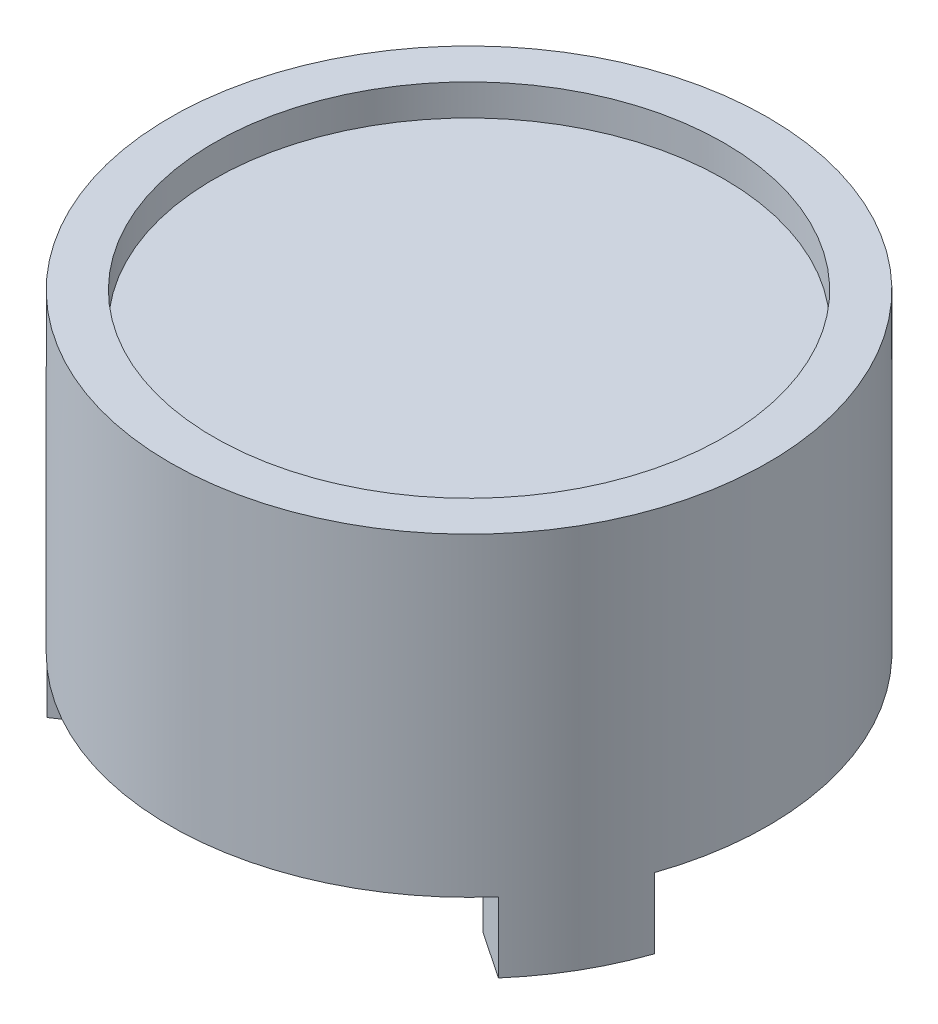
from build123d import *
from build123d.topology import SkipClean

# Parameters (mm, degrees)
TOOTH_DEPTH       = 4
THREE_TEETH_COUNT = 3
FILLET1_R         = 0.254


with BuildPart() as part:
    # Sketch4 → Revolve1 (revolve)
    with BuildSketch(Plane.XY, mode=Mode.PRIVATE) as revolve1_sk:
        Polygon((0, 16.1036), (14.5, 16.1036), (14.5, 17.8816), (17, 17.8816), (17, 0), (13.5, 0), (13.5, 1), (14.5, 1), (14.5, 3.4036), (0, 3.4036), align=None)
    revolve(revolve1_sk.sketch.rotate(Axis((0, 0, 0), (0, 1, 0)), 90), axis=Axis((0, 0, 0), (0, 1, 0)))

    # Sketch3 → Tooth (add)
    with SkipClean():  # the faces are left unmerged after this step: merging them gives an invalid solid
        with BuildSketch(Plane(origin=(0, 0, 0), x_dir=(1, 0, 0), z_dir=(0, 1, 0))):
            with BuildLine():
                Line((-3.25, 16.686447), (-3, 13.162447))
                ThreePointArc((-3, 13.162447), (0, 13.5), (3, 13.162447))
                Line((3, 13.162447), (3.25, 16.686447))
                ThreePointArc((3.25, 16.686447), (0, 17), (-3.25, 16.686447))
            make_face()
        tooth = extrude(amount=-TOOTH_DEPTH)

    # Three Teeth: Tooth ×3 about axis
    with SkipClean():  # the faces are left unmerged after this step: merging them gives an invalid solid
        three_teeth_axis = Axis((0, 0, 0), (0, 1, 0))
        for i in range(1, THREE_TEETH_COUNT):
            add(tooth.rotate(three_teeth_axis, i * 360 / THREE_TEETH_COUNT))

    # Fillet1
    fillet1_edges = [part.edges().sort_by_distance(p)[0] for p in [
        (-12.899013, -2, 3.983147),
        (-9.899013, -2, 9.1793),
        (-3, -2, -13.162447),
        (3, -2, -13.162447),
        (12.899013, -2, 3.983147),
        (9.899013, -2, 9.1793),
    ]]
    fillet(fillet1_edges, radius=FILLET1_R)


solid = part.part
